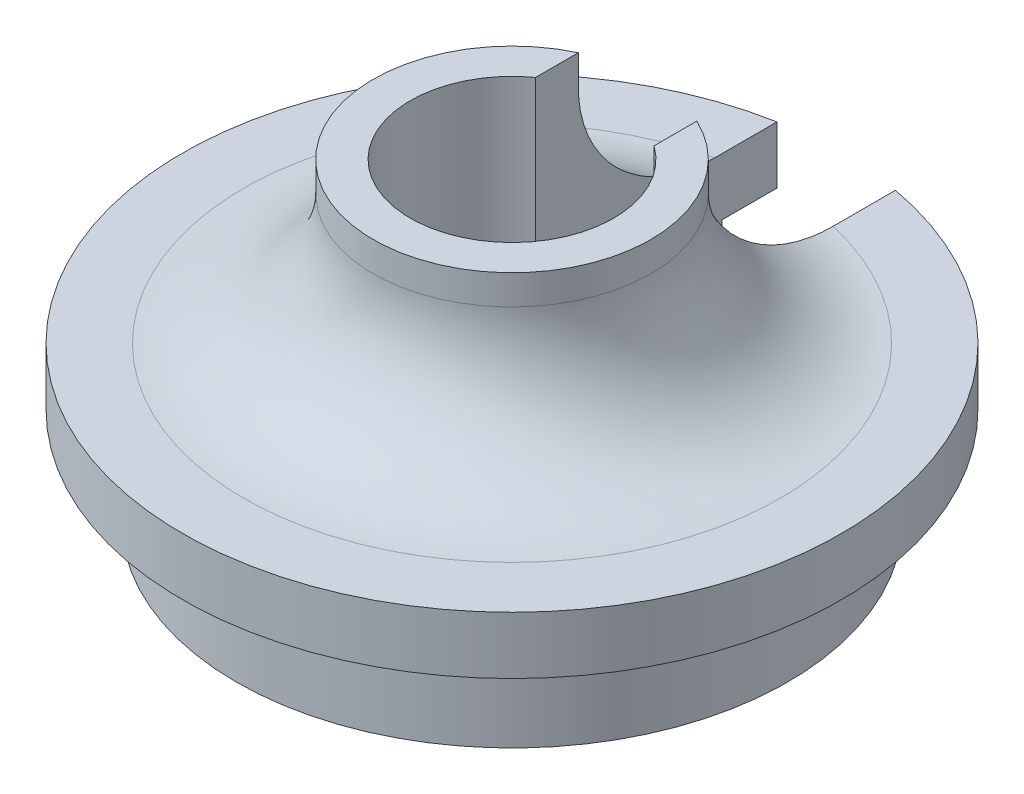
from build123d import *

# Parameters (mm, degrees)
CUT_EXTRUDE1_DEPTH      = 14.879571319
CUT_EXTRUDE1_DEPTH_BACK = 14.879571319
SKETCH3_R               = 1
CUT_EXTRUDE2_DEPTH      = 1


with BuildPart() as part:
    # Sketch1 → Revolve1 (revolve)
    with BuildSketch(Plane(origin=(0, 0, 0), x_dir=(0, 0, -1), z_dir=(1, 0, 0))):
        with BuildLine():
            Line((0, 0), (2.75, 0))
            Line((2.75, 0), (2.75, 4.3))
            Line((2.75, 4.3), (3.75, 4.3))
            Line((3.75, 4.3), (3.75, 3.5))
            ThreePointArc((3.75, 3.5), (4.775126266, 1.025126266), (7.25, 0))
            Line((7.25, 0), (8.9, 0))
            Line((8.9, 0), (8.9, -1.55))
            Line((8.9, -1.55), (7.45, -1.55))
            Line((7.45, -1.55), (7.45, -4.2))
            Line((7.45, -4.2), (6.65, -4.2))
            Line((6.65, -4.2), (6.65, -1.55))
            Line((6.65, -1.55), (0, -1.55))
            Line((0, -1.55), (0, 0))
        make_face()
    revolve(axis=Axis((0, -1.55, 0), (0, 1, 0)))

    # Sketch2 → Cut-Extrude1 (cut, two sides: drawn at the far end of the back side and taken through both)
    with BuildSketch(Plane.XZ.offset(1.55).offset(-CUT_EXTRUDE1_DEPTH_BACK)):
        with BuildLine():
            Line((1.6, 0), (1.6, -8.9))
            ThreePointArc((1.6, -8.9), (0, -10.5), (-1.6, -8.9))
            Line((-1.6, -8.9), (-1.6, 0))
            ThreePointArc((-1.6, 0), (0, 1.6), (1.6, 0))
        make_face()
    extrude(amount=CUT_EXTRUDE1_DEPTH + CUT_EXTRUDE1_DEPTH_BACK, mode=Mode.SUBTRACT)

    # Sketch3 → Cut-Extrude2 (cut)
    with BuildSketch(Plane.XZ.offset(1.55)):
        with Locations(Location((-4.330127019, -2.5, 0), (0, 0, 270))):
            Circle(SKETCH3_R)
        with Locations(Location((-4.330127019, 2.5, 0), (0, 0, 270))):
            Circle(SKETCH3_R)
        with Locations(Location((0, 5, 0), (0, 0, 270))):
            Circle(SKETCH3_R)
        with Locations(Location((4.330127019, 2.5, 0), (0, 0, 270))):
            Circle(SKETCH3_R)
        with Locations(Location((4.330127019, -2.5, 0), (0, 0, 270))):
            Circle(SKETCH3_R)
        with Locations((0, -5)):
            Circle(SKETCH3_R)
    extrude(amount=-CUT_EXTRUDE2_DEPTH, mode=Mode.SUBTRACT)


solid = part.part
